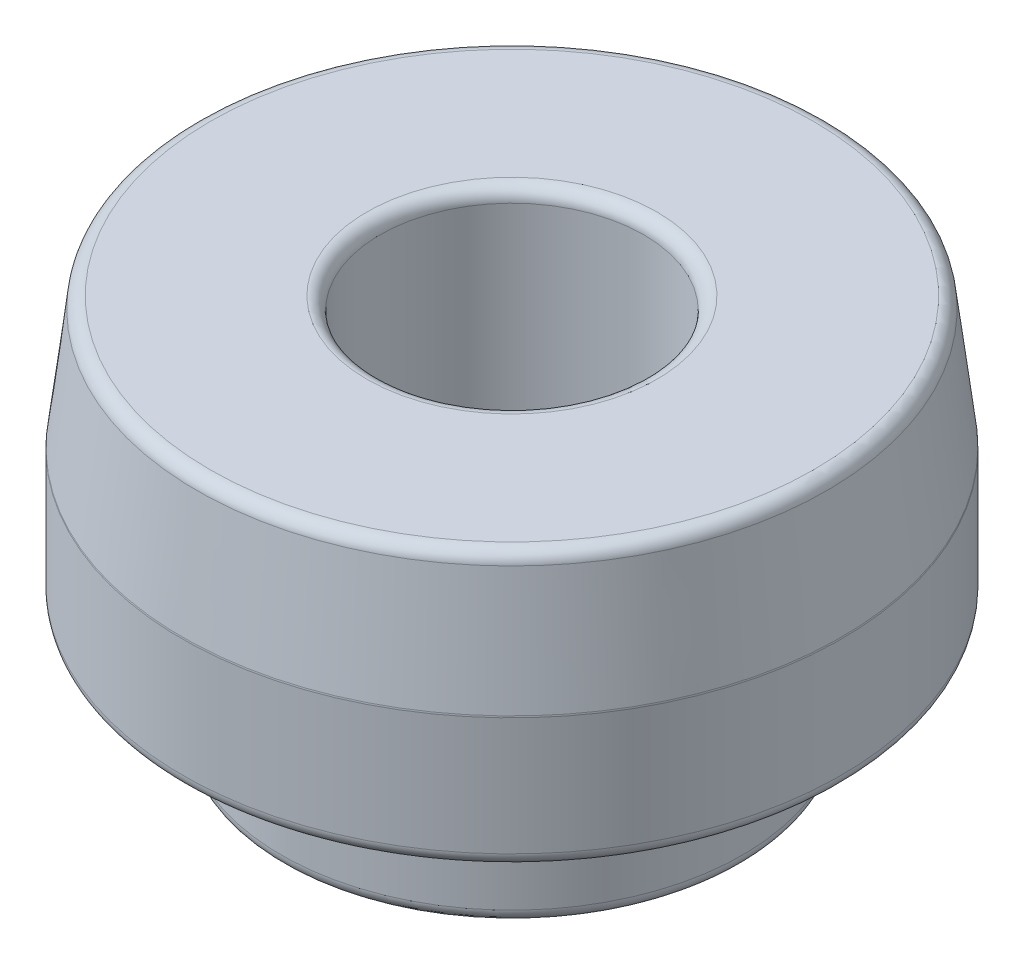
from build123d import *


with BuildPart() as part:
    # Sketch1 → Revolve1 (revolve)
    with BuildSketch(Plane.XY, mode=Mode.PRIVATE) as revolve1_sk:
        with BuildLine():
            Line((5.5, 10), (11.443714563, 10))
            ThreePointArc((11.443714563, 10), (11.775024587, 9.87447786), (11.939987639, 9.560934672))
            Line((11.939987639, 9.560934672), (12.496273076, 5.030353362))
            ThreePointArc((12.496273076, 5.030353362), (12.499067399, 4.99994296), (12.5, 4.96941869))
            Line((12.5, 4.96941869), (12.5, 0.5))
            ThreePointArc((12.5, 0.5), (12.353553391, 0.146446609), (12, 0))
            Line((12, 0), (9.25, 0))
            ThreePointArc((9.25, 0), (8.896446609, -0.146446609), (8.75, -0.5))
            Line((8.75, -0.5), (8.75, -4))
            ThreePointArc((8.75, -4), (8.603553391, -4.353553391), (8.25, -4.5))
            Line((8.25, -4.5), (5.5, -4.5))
            ThreePointArc((5.5, -4.5), (5.146446609, -4.353553391), (5, -4))
            Line((5, -4), (5, 9.5))
            ThreePointArc((5, 9.5), (5.146446609, 9.853553391), (5.5, 10))
        make_face()
    revolve(revolve1_sk.sketch.rotate(Axis((0, 0, 0), (0, 1, 0)), 90), axis=Axis((0, 0, 0), (0, 1, 0)))


solid = part.part
